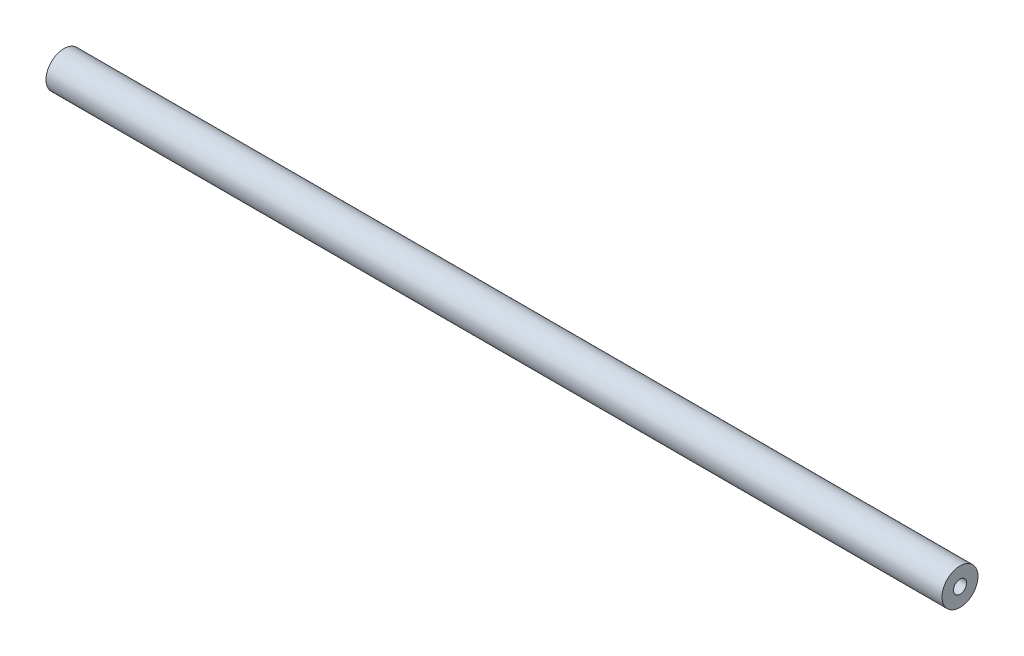
from build123d import *

# Parameters (mm, degrees)
SKETCH_1_R      = 4.5
SKETCH_1_R_2    = 1.65
EXTRUDE_1_DEPTH = 224


with BuildPart() as part:
    # 草图1 → 凸台-拉伸1 (new body)
    with BuildSketch(Plane(origin=(0, 0, 0), x_dir=(0, 0, -1), z_dir=(1, 0, 0))):
        Circle(SKETCH_1_R)
        Circle(SKETCH_1_R_2, mode=Mode.SUBTRACT)
    extrude(amount=EXTRUDE_1_DEPTH)


solid = part.part
